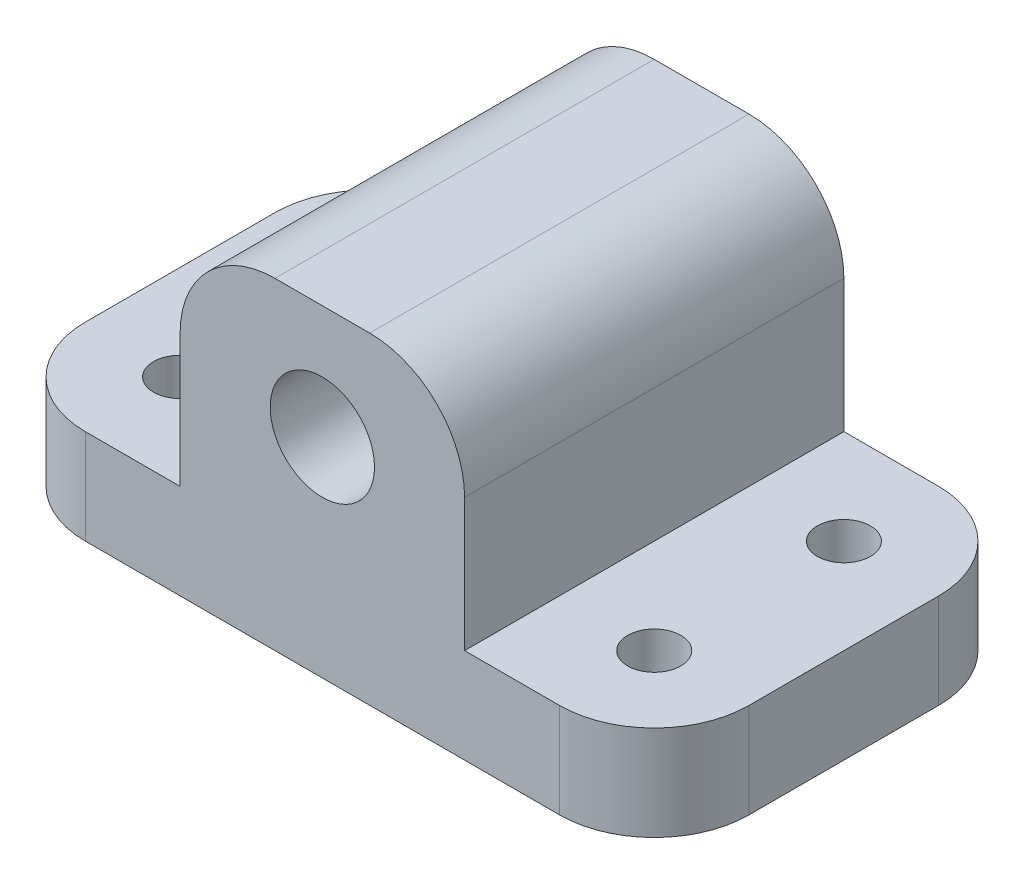
from build123d import *

# Parameters (mm, degrees)
SKETCH1_R           = 3.4925
BOSS_EXTRUDE1_DEPTH = 25.4
SKETCH2_R           = 1.778
CUT_EXTRUDE1_DEPTH  = 54.415541746
FILLET2_R           = 6.35
FILLET1_R           = 6.35


with BuildPart() as part:
    # Sketch1 → Boss-Extrude1 (new body)
    with BuildSketch(Plane.XY):
        Polygon((0, 0), (44.45, 0), (44.45, 6.35), (31.75, 6.35), (31.75, 21.59), (12.7, 21.59), (12.7, 6.35), (0, 6.35), align=None)
        with Locations((22.225, 13.97)):
            Circle(SKETCH1_R, mode=Mode.SUBTRACT)
    extrude(amount=BOSS_EXTRUDE1_DEPTH)

    # Sketch2 → Cut-Extrude1 (cut, through all)
    with BuildSketch(Plane(origin=(0, 6.35, 0), x_dir=(1, 0, 0), z_dir=(0, 1, 0))):
        with Locations(Location((6.35, -6.35, 0), (0, 0, 270))):
            Circle(SKETCH2_R)
        with Locations(Location((6.35, -19.05, 0), (0, 0, 270))):
            Circle(SKETCH2_R)
        with Locations(Location((38.1, -6.35, 0), (0, 0, 270))):
            Circle(SKETCH2_R)
        with Locations(Location((38.1, -19.05, 0), (0, 0, 270))):
            Circle(SKETCH2_R)
    extrude(amount=-CUT_EXTRUDE1_DEPTH, mode=Mode.SUBTRACT)

    # Fillet2
    fillet2_edges = [part.edges().sort_by_distance(p)[0] for p in [
        (12.7, 21.59, 12.7),
        (31.75, 21.59, 12.7),
    ]]
    fillet(fillet2_edges, radius=FILLET2_R)

    # Fillet1
    fillet1_edges = [part.edges().sort_by_distance(p)[0] for p in [
        (44.45, 3.175, 0),
        (0, 3.175, 0),
        (44.45, 3.175, 25.4),
        (0, 3.175, 25.4),
    ]]
    fillet(fillet1_edges, radius=FILLET1_R)


solid = part.part
